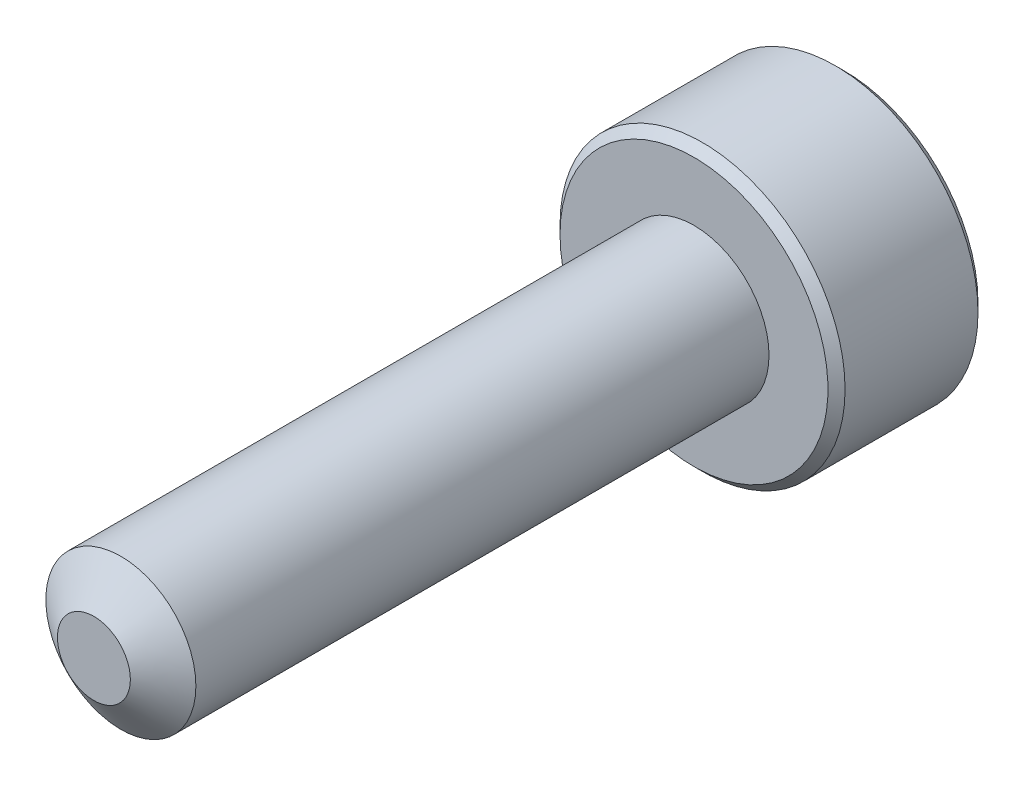
from build123d import *

# Parameters (mm, degrees)
SKETCH1_R          = 1
EXTRUDE1_DEPTH     = 8
SKETCH6_R          = 1.9
EXTRUDE2_DEPTH     = 2
CUT_EXTRUDE1_DEPTH = 1.125
CHAMFER1_SIZE      = 0.114


with BuildPart() as part:
    # Sketch1 → Extrude1 (new body)
    with BuildSketch(Plane.XY):
        Circle(SKETCH1_R)
    extrude(amount=-EXTRUDE1_DEPTH)

    # Sketch4 → Cut-Revolve1 (revolve, cut)
    with BuildSketch(Plane(origin=(0, 0, 0), x_dir=(0, 0, -1), z_dir=(1, 0, 0)), mode=Mode.PRIVATE) as cut_revolve1_sk:
        Polygon((0.35977197, 1), (0, 0.486192379), (0, 1), align=None)
    revolve(cut_revolve1_sk.sketch.rotate(Axis((0, 0, 0), (0, 0, -1)), 90), axis=Axis((0, 0, 0), (0, 0, -1)), mode=Mode.SUBTRACT)

    # Sketch6 → Extrude2 (add)
    with BuildSketch(Plane(origin=(0, 0, -8), x_dir=(-1, 0, 0), z_dir=(0, 0, -1))):
        Circle(SKETCH6_R)
    extrude(amount=EXTRUDE2_DEPTH)

    # Sketch7 → Cut-Extrude1 (cut)
    with BuildSketch(Plane(origin=(0, 0, -10), x_dir=(-1, 0, 0), z_dir=(0, 0, -1))):
        Polygon((0, 0.866025404), (-0.75, 0.433012702), (-0.75, -0.433012702), (0, -0.866025404), (0.75, -0.433012702), (0.75, 0.433012702), align=None)
    extrude(amount=-CUT_EXTRUDE1_DEPTH, mode=Mode.SUBTRACT)

    # Cut-Extrude2 cone 1 section (through the dimple's axis) → Cut-Extrude2 (revolve, cut)
    with BuildSketch(Plane(origin=(0, 0, -10), x_dir=(0, 1, 0), z_dir=(1, 0, 0))):
        Polygon((0, 0), (0.866025404, 0), (0, 0.866025404), align=None)
    revolve(axis=Axis((0, 0, -10), (0, 0, 1)), mode=Mode.SUBTRACT)

    # Chamfer1
    chamfer1_edges = [part.edges().sort_by_distance(p)[0] for p in [
        (1.9, 0, -8),
        (1.9, 0, -10),
    ]]
    chamfer(chamfer1_edges, length=CHAMFER1_SIZE)

    # Sketch10 → Revolve1 (revolve)
    with BuildSketch(Plane(origin=(0, 0, 0), x_dir=(0, 0, -1), z_dir=(1, 0, 0)), mode=Mode.PRIVATE) as revolve1_sk:
        Polygon((8, 1), (8, 0), (7.485786438, 0), (7.9, 1), align=None)
    revolve(revolve1_sk.sketch.rotate(Axis((0, 0, -8), (0, 0, 1)), 270), axis=Axis((0, 0, -8), (0, 0, 1)))


solid = part.part
